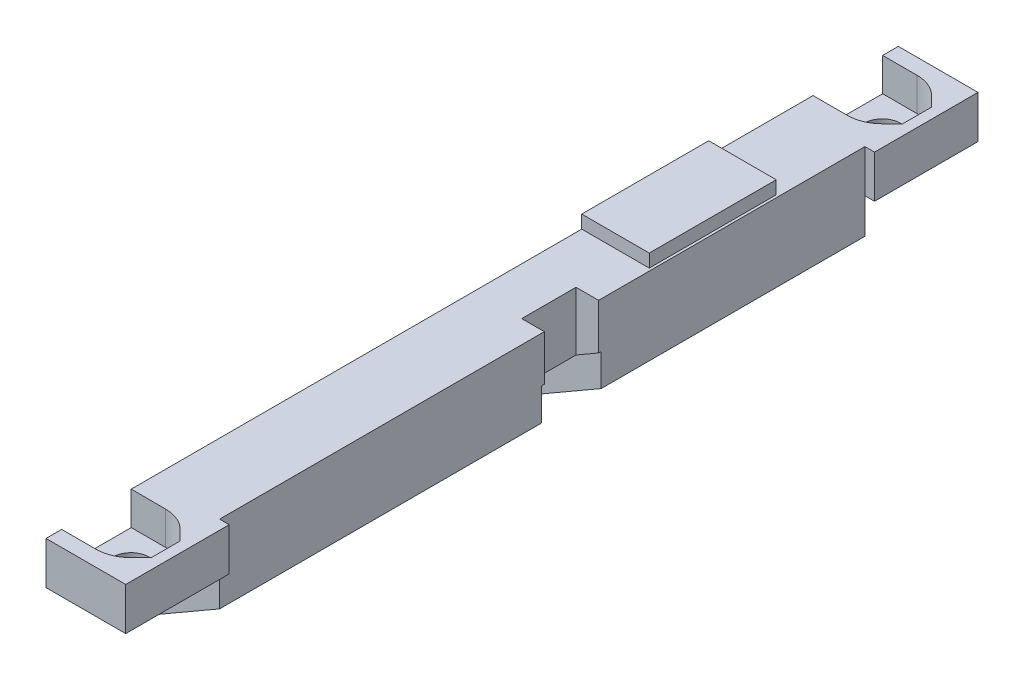
from build123d import *

# Parameters (mm, degrees)
CLAMP_START                     = -20.15
CLAMP_X_BASE_DEPTH              = 37.1
WIRE_START                      = -4.99
WIRE_CHANNEL_X_BASE_Z_5_0_DEPTH = 3.42
WIRE_START_2                    = -4.84
SKETCH3_W                       = 1.6
SKETCH3_H                       = 4.320657937
WIRE_NOTCH_X_BASE_Z_5_0_DEPTH   = 3.12
EAR_START                       = -26.1
SKETCH4_W                       = 4.582851153
SKETCH4_H                       = 2.45
EAR_X_BASE_26_DEPTH             = 5.95
EAR_START_2                     = 16.95
SKETCH5_W                       = 4.582851153
SKETCH5_H                       = 2.45
EAR_X_BASE_17_DEPTH             = 5.95
CUT_EXTRUDE3_START              = -6.55
SKETCH6_R                       = 1.05
CUT_EXTRUDE3_DEPTH              = 2.65
CUT_EXTRUDE4_START              = -5.91
SKETCH7_R                       = 2
CUT_EXTRUDE4_DEPTH              = 1.92
CUT_EXTRUDE5_START              = -5.91
SKETCH8_W                       = 2.082851153
SKETCH8_H                       = 4
CUT_EXTRUDE5_DEPTH              = 1.92
CUT_EXTRUDE6_START              = -5.91
CUT_EXTRUDE6_DEPTH              = 1.92
CUT_EXTRUDE7_START              = -5.91
CUT_EXTRUDE7_DEPTH              = 1.92
BOSS_EXTRUDE4_START             = -4
SKETCH11_W                      = 3.882851153
SKETCH11_H                      = 7.3
BOSS_EXTRUDE4_DEPTH             = 0.75


with BuildPart() as part:
    # Sketch1 → Clamp +X base (new body)
    with BuildSketch(Plane.XY.offset(CLAMP_START)):
        Polygon((13.367148847, -4), (17.397275866, -4), (17.397275866, -8.470102587), (13.367148847, -10.796897507), align=None)
    extrude(amount=CLAMP_X_BASE_DEPTH)

    # Sketch2 → Wire channel +X base Z -5.0 (cut)
    with BuildSketch(Plane.XY.offset(WIRE_START)):
        Polygon((11.102085338, -12.220102587), (19.762339376, -7.220102587), (18.912339376, -5.747859401), (10.252085338, -10.747859401), align=None)
    extrude(amount=WIRE_CHANNEL_X_BASE_Z_5_0_DEPTH, mode=Mode.SUBTRACT)

    # Sketch3 → Wire notch +X base Z -5.0 (cut)
    with BuildSketch(Plane.XY.offset(WIRE_START_2)):
        with Locations((16.897275866, -6.060328969)):
            Rectangle(SKETCH3_W, SKETCH3_H)
    extrude(amount=WIRE_NOTCH_X_BASE_Z_5_0_DEPTH, mode=Mode.SUBTRACT)

    # Sketch4 → Ear +X base -26 (add)
    with BuildSketch(Plane.XY.offset(EAR_START)):
        with Locations((15.658574424, -5.225)):
            Rectangle(SKETCH4_W, SKETCH4_H)
    extrude(amount=EAR_X_BASE_26_DEPTH)

    # Sketch5 → Ear +X base 17 (add)
    with BuildSketch(Plane.XY.offset(EAR_START_2)):
        with Locations((15.658574424, -5.225)):
            Rectangle(SKETCH5_W, SKETCH5_H)
    extrude(amount=EAR_X_BASE_17_DEPTH)

    # Sketch6 → Cut-Extrude3 (cut)
    with BuildSketch(Plane(origin=(0, 0, 0), x_dir=(1, 0, 0), z_dir=(0, 1, 0)).offset(CUT_EXTRUDE3_START)):
        with Locations(Location((15.35, 23.2, 0), (0, 0, 90))):
            Circle(SKETCH6_R)
        with Locations(Location((15.35, -20, 0), (0, 0, 90))):
            Circle(SKETCH6_R)
    extrude(amount=CUT_EXTRUDE3_DEPTH, mode=Mode.SUBTRACT)

    # Sketch7 → Cut-Extrude4 (cut)
    with BuildSketch(Plane(origin=(0, 0, 0), x_dir=(1, 0, 0), z_dir=(0, 1, 0)).offset(CUT_EXTRUDE4_START)):
        with Locations((15.35, 23.2)):
            Circle(SKETCH7_R)
        with Locations((15.35, -20)):
            Circle(SKETCH7_R)
    extrude(amount=CUT_EXTRUDE4_DEPTH, mode=Mode.SUBTRACT)

    # Sketch8 → Cut-Extrude5 (cut)
    with BuildSketch(Plane(origin=(0, 0, 0), x_dir=(1, 0, 0), z_dir=(0, 1, 0)).offset(CUT_EXTRUDE5_START)):
        with Locations((14.308574424, 23.2)):
            Rectangle(SKETCH8_W, SKETCH8_H)
        with Locations((14.308574424, -20)):
            Rectangle(SKETCH8_W, SKETCH8_H)
    extrude(amount=CUT_EXTRUDE5_DEPTH, mode=Mode.SUBTRACT)

    # Sketch9 → Cut-Extrude6 (cut)
    with BuildSketch(Plane(origin=(0, 0, 0), x_dir=(1, 0, 0), z_dir=(0, 1, 0)).offset(CUT_EXTRUDE6_START)):
        Polygon((15.35, 25.2), (16.764213562, 24.614213562), (17.35, 24.028427125), (17.35, 22.371572875), (16.764213562, 21.785786438), (15.35, 21.2), align=None)
    extrude(amount=CUT_EXTRUDE6_DEPTH, mode=Mode.SUBTRACT)

    # Sketch10 → Cut-Extrude7 (cut)
    with BuildSketch(Plane(origin=(0, 0, 0), x_dir=(1, 0, 0), z_dir=(0, 1, 0)).offset(CUT_EXTRUDE7_START)):
        Polygon((15.35, -18), (16.764213562, -18.585786438), (17.35, -19.171572875), (17.35, -20.828427125), (16.764213562, -21.414213562), (15.35, -22), align=None)
    extrude(amount=CUT_EXTRUDE7_DEPTH, mode=Mode.SUBTRACT)

    # Sketch11 → Boss-Extrude4 (add)
    with BuildSketch(Plane(origin=(0, 0, 0), x_dir=(1, 0, 0), z_dir=(0, 1, 0)).offset(BOSS_EXTRUDE4_START)):
        with Locations((15.308574424, 11.55)):
            Rectangle(SKETCH11_W, SKETCH11_H)
    extrude(amount=BOSS_EXTRUDE4_DEPTH)


solid = part.part
